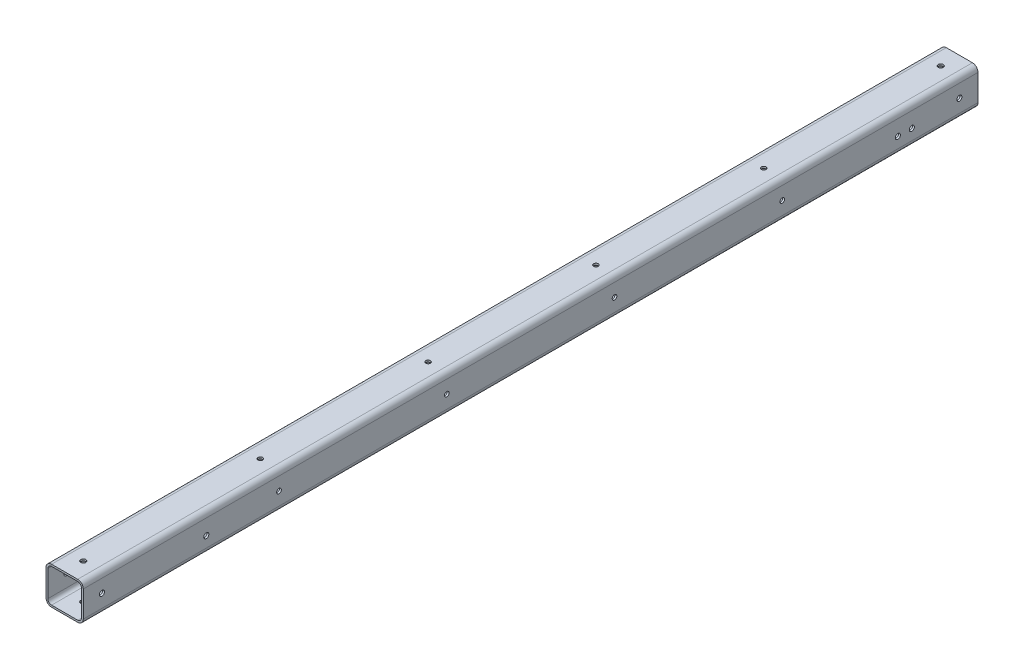
from build123d import *

# Parameters (mm, degrees)
AUFSATZ_LINEAR_AUSTRAGEN1_DEPTH = 480
SKIZZE2_R                       = 2.75
SCHNITT_LINEAR_AUSTRAGEN1_DEPTH = 100
SKIZZE3_R                       = 2.75
SCHNITT_LINEAR_AUSTRAGEN2_DEPTH = 100
SKIZZE4_R                       = 2.75
SCHNITT_LINEAR_AUSTRAGEN3_DEPTH = 10
SKIZZE5_R                       = 2.5
SCHNITT_LINEAR_AUSTRAGEN4_DEPTH = 60
SKIZZE6_R                       = 2.5
SCHNITT_LINEAR_AUSTRAGEN5_DEPTH = 100


with BuildPart() as part:
    # Skizze1 → Aufsatz-Linear austragen1 (new, symmetric)
    with BuildSketch(Plane.XY):
        with BuildLine():
            Line((-14, 20), (14, 20))
            ThreePointArc((14, 20), (18.242640687, 18.242640687), (20, 14))
            Line((20, 14), (20, -14))
            ThreePointArc((20, -14), (18.242640687, -18.242640687), (14, -20))
            Line((14, -20), (-14, -20))
            ThreePointArc((-14, -20), (-18.242640687, -18.242640687), (-20, -14))
            Line((-20, -14), (-20, 14))
            ThreePointArc((-20, 14), (-18.242640687, 18.242640687), (-14, 20))
        make_face()
        with BuildLine():
            Line((-18, 14), (-18, -14))
            ThreePointArc((-18, -14), (-16.828427125, -16.828427125), (-14, -18))
            Line((-14, -18), (14, -18))
            ThreePointArc((14, -18), (16.828427125, -16.828427125), (18, -14))
            Line((18, -14), (18, 14))
            ThreePointArc((18, 14), (16.828427125, 16.828427125), (14, 18))
            Line((14, 18), (-14, 18))
            ThreePointArc((-14, 18), (-16.828427125, 16.828427125), (-18, 14))
        make_face(mode=Mode.SUBTRACT)
    extrude(amount=AUFSATZ_LINEAR_AUSTRAGEN1_DEPTH, both=True)

    # Skizze2 → Schnitt-Linear austragen1 (cut)
    with BuildSketch(Plane(origin=(0, 20, 0), x_dir=(1, 0, 0), z_dir=(0, 1, 0))):
        with Locations(Location((0, 460, 0), (0, 0, 270))):
            Circle(SKIZZE2_R)
        with Locations((0, -460)):
            Circle(SKIZZE2_R)
    extrude(amount=-SCHNITT_LINEAR_AUSTRAGEN1_DEPTH, mode=Mode.SUBTRACT)

    # Skizze3 → Schnitt-Linear austragen2 (cut)
    with BuildSketch(Plane(origin=(20, 0, 0), x_dir=(0, 0, -1), z_dir=(1, 0, 0))):
        with Locations((460, 0)):
            Circle(SKIZZE3_R)
        with Locations(Location((-460, 0, 0), (0, 0, 180))):
            Circle(SKIZZE3_R)
    extrude(amount=-SCHNITT_LINEAR_AUSTRAGEN2_DEPTH, mode=Mode.SUBTRACT)

    # Skizze4 → Schnitt-Linear austragen3 (cut)
    with BuildSketch(Plane(origin=(20, 0, 0), x_dir=(0, 0, -1), z_dir=(1, 0, 0))):
        with Locations((409, -2.5)):
            Circle(SKIZZE4_R)
        with Locations((394, -2.5)):
            Circle(SKIZZE4_R)
        with Locations((-348, -2.5)):
            Circle(SKIZZE4_R)
    extrude(amount=-SCHNITT_LINEAR_AUSTRAGEN3_DEPTH, mode=Mode.SUBTRACT)

    # Skizze5 → Schnitt-Linear austragen4 (cut)
    with BuildSketch(Plane(origin=(0, 20, 0), x_dir=(1, 0, 0), z_dir=(0, 1, 0))):
        with Locations(Location((0, 270, 0), (0, 0, 270))):
            Circle(SKIZZE5_R)
        with Locations(Location((0, 90, 0), (0, 0, 270))):
            Circle(SKIZZE5_R)
        with Locations((0, -270)):
            Circle(SKIZZE5_R)
        with Locations((0, -90)):
            Circle(SKIZZE5_R)
    extrude(amount=-SCHNITT_LINEAR_AUSTRAGEN4_DEPTH, mode=Mode.SUBTRACT)

    # Skizze6 → Schnitt-Linear austragen5 (cut)
    with BuildSketch(Plane.ZY.offset(20)):
        with Locations((270, 0)):
            Circle(SKIZZE6_R)
        with Locations((90, 0)):
            Circle(SKIZZE6_R)
        with Locations((-270, 0)):
            Circle(SKIZZE6_R)
        with Locations((-90, 0)):
            Circle(SKIZZE6_R)
    extrude(amount=-SCHNITT_LINEAR_AUSTRAGEN5_DEPTH, mode=Mode.SUBTRACT)


solid = part.part
